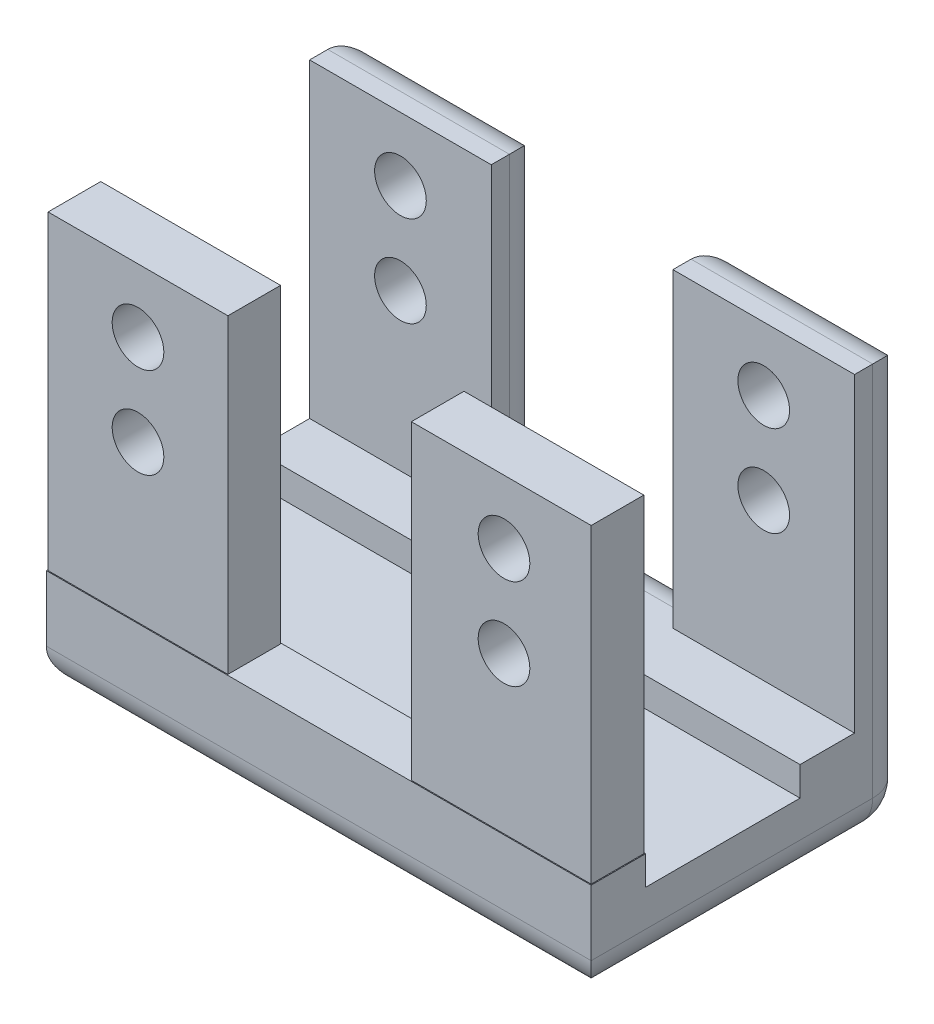
from build123d import *

# Parameters (mm, degrees)
SKETCH1_W           = 30
SKETCH1_H           = 17.5
BOSS_EXTRUDE1_DEPTH = 4
SKETCH2_W           = 30
SKETCH2_H           = 6
BOSS_EXTRUDE2_DEPTH = 1.601
SKETCH3_W           = 10
SKETCH3_H           = 3
BOSS_EXTRUDE3_DEPTH = 18.7
SKETCH4_W           = 10
SKETCH4_H           = 3
BOSS_EXTRUDE4_DEPTH = 17.099
SKETCH5_W           = 10
SKETCH5_H           = 3
BOSS_EXTRUDE5_DEPTH = 1.601
FILLET1_R           = 2
CUT_EXTRUDE1_REACH  = 42.318
SKETCH6_R           = 1.4224
CUT_EXTRUDE2_REACH  = 42.318
SKETCH7_R           = 1.4224
SKETCH9_W           = 10
SKETCH9_H           = 3
SKETCH9_W_2         = 9.9
SKETCH9_H_2         = 2.9
CUT_EXTRUDE3_DEPTH  = 17.099


with BuildPart() as part:
    # Sketch1 → Boss-Extrude1 (new body)
    with BuildSketch(Plane(origin=(0, 0, 0), x_dir=(1, 0, 0), z_dir=(0, 1, 0))):
        with Locations((15, 8.75)):
            Rectangle(SKETCH1_W, SKETCH1_H)
    extrude(amount=BOSS_EXTRUDE1_DEPTH)

    # Sketch2 → Boss-Extrude2 (add)
    with BuildSketch(Plane(origin=(0, 4, 0), x_dir=(1, 0, 0), z_dir=(0, 1, 0))):
        with Locations((15, 14.5)):
            Rectangle(SKETCH2_W, SKETCH2_H)
    extrude(amount=BOSS_EXTRUDE2_DEPTH)

    # Sketch3 → Boss-Extrude3 (add)
    with BuildSketch(Plane(origin=(0, 4, 0), x_dir=(1, 0, 0), z_dir=(0, 1, 0))):
        with Locations((5, 1.5)):
            Rectangle(SKETCH3_W, SKETCH3_H)
        with Locations((25, 1.5)):
            Rectangle(SKETCH3_W, SKETCH3_H)
    extrude(amount=BOSS_EXTRUDE3_DEPTH)

    # Sketch4 → Boss-Extrude4 (add)
    with BuildSketch(Plane(origin=(0, 5.601, 0), x_dir=(1, 0, 0), z_dir=(0, 1, 0))):
        with Locations((5, 16)):
            Rectangle(SKETCH4_W, SKETCH4_H)
        with Locations((25, 16)):
            Rectangle(SKETCH4_W, SKETCH4_H)
    extrude(amount=BOSS_EXTRUDE4_DEPTH)

    # Sketch5 → Boss-Extrude5 (add)
    with BuildSketch(Plane(origin=(0, 4, 0), x_dir=(1, 0, 0), z_dir=(0, 1, 0))):
        with Locations((15, 1.5)):
            Rectangle(SKETCH5_W, SKETCH5_H)
    extrude(amount=BOSS_EXTRUDE5_DEPTH)

    # Fillet1
    fillet1_edges = [part.edges().sort_by_distance(p)[0] for p in [
        (15, 0, -17.5),
        (30, 0, -8.75),
        (15, 0, 0),
        (10, 14.1505, -17.5),
        (5, 22.7, -17.5),
        (0, 0, -8.75),
        (15, 5.601, -17.5),
        (20, 14.1505, -17.5),
        (25, 22.7, -17.5),
        (0, 11.35, -17.5),
        (30, 11.35, -17.5),
    ]]
    fillet(fillet1_edges, radius=FILLET1_R)

    # Sketch6 → Cut-Extrude1 (cut, up to next)
    with BuildSketch(Plane.XY.offset(-14.5), mode=Mode.PRIVATE) as cut_extrude1_sk1:
        with Locations((5, 19.2)):
            Circle(SKETCH6_R)
    cut_extrude1_tool1 = extrude(cut_extrude1_sk1.sketch, amount=-CUT_EXTRUDE1_REACH, mode=Mode.PRIVATE) & part.part
    # Sketch6 → Cut-Extrude1 (cut, up to next)
    with BuildSketch(Plane.XY.offset(-14.5), mode=Mode.PRIVATE) as cut_extrude1_sk2:
        with Locations((25, 19.2)):
            Circle(SKETCH6_R)
    cut_extrude1_tool2 = extrude(cut_extrude1_sk2.sketch, amount=-CUT_EXTRUDE1_REACH, mode=Mode.PRIVATE) & part.part
    # Sketch6 → Cut-Extrude1 (cut, up to next)
    with BuildSketch(Plane.XY.offset(-14.5), mode=Mode.PRIVATE) as cut_extrude1_sk3:
        with Locations((5, 14.2)):
            Circle(SKETCH6_R)
    cut_extrude1_tool3 = extrude(cut_extrude1_sk3.sketch, amount=-CUT_EXTRUDE1_REACH, mode=Mode.PRIVATE) & part.part
    # Sketch6 → Cut-Extrude1 (cut, up to next)
    with BuildSketch(Plane.XY.offset(-14.5), mode=Mode.PRIVATE) as cut_extrude1_sk4:
        with Locations((25, 14.2)):
            Circle(SKETCH6_R)
    cut_extrude1_tool4 = extrude(cut_extrude1_sk4.sketch, amount=-CUT_EXTRUDE1_REACH, mode=Mode.PRIVATE) & part.part
    add(cut_extrude1_tool1.solids().sort_by_distance((5, 19.2, -14.5))[0], mode=Mode.SUBTRACT)
    add(cut_extrude1_tool2.solids().sort_by_distance((25, 19.2, -14.5))[0], mode=Mode.SUBTRACT)
    add(cut_extrude1_tool3.solids().sort_by_distance((5, 14.2, -14.5))[0], mode=Mode.SUBTRACT)
    add(cut_extrude1_tool4.solids().sort_by_distance((25, 14.2, -14.5))[0], mode=Mode.SUBTRACT)

    # Sketch7 → Cut-Extrude2 (cut, up to next)
    with BuildSketch(Plane(origin=(0, 0, -3), x_dir=(-1, 0, 0), z_dir=(0, 0, -1)), mode=Mode.PRIVATE) as cut_extrude2_sk1:
        with Locations(Location((-5, 19.2, 0), (0, 0, 180))):
            Circle(SKETCH7_R)
    cut_extrude2_tool1 = extrude(cut_extrude2_sk1.sketch, amount=-CUT_EXTRUDE2_REACH, mode=Mode.PRIVATE) & part.part
    # Sketch7 → Cut-Extrude2 (cut, up to next)
    with BuildSketch(Plane(origin=(0, 0, -3), x_dir=(-1, 0, 0), z_dir=(0, 0, -1)), mode=Mode.PRIVATE) as cut_extrude2_sk2:
        with Locations((-25.150725931, 19.2)):
            Circle(SKETCH7_R)
    cut_extrude2_tool2 = extrude(cut_extrude2_sk2.sketch, amount=-CUT_EXTRUDE2_REACH, mode=Mode.PRIVATE) & part.part
    # Sketch7 → Cut-Extrude2 (cut, up to next)
    with BuildSketch(Plane(origin=(0, 0, -3), x_dir=(-1, 0, 0), z_dir=(0, 0, -1)), mode=Mode.PRIVATE) as cut_extrude2_sk3:
        with Locations((-25.150725931, 14.2)):
            Circle(SKETCH7_R)
    cut_extrude2_tool3 = extrude(cut_extrude2_sk3.sketch, amount=-CUT_EXTRUDE2_REACH, mode=Mode.PRIVATE) & part.part
    # Sketch7 → Cut-Extrude2 (cut, up to next)
    with BuildSketch(Plane(origin=(0, 0, -3), x_dir=(-1, 0, 0), z_dir=(0, 0, -1)), mode=Mode.PRIVATE) as cut_extrude2_sk4:
        with Locations(Location((-5, 14.2, 0), (0, 0, 180))):
            Circle(SKETCH7_R)
    cut_extrude2_tool4 = extrude(cut_extrude2_sk4.sketch, amount=-CUT_EXTRUDE2_REACH, mode=Mode.PRIVATE) & part.part
    add(cut_extrude2_tool1.solids().sort_by_distance((5, 19.2, -3))[0], mode=Mode.SUBTRACT)
    add(cut_extrude2_tool2.solids().sort_by_distance((25.150726, 19.2, -3))[0], mode=Mode.SUBTRACT)
    add(cut_extrude2_tool3.solids().sort_by_distance((25.150726, 14.2, -3))[0], mode=Mode.SUBTRACT)
    add(cut_extrude2_tool4.solids().sort_by_distance((5, 14.2, -3))[0], mode=Mode.SUBTRACT)

    # Sketch9 → Cut-Extrude3 (cut)
    # profile 1 of 2: a face of its own
    with BuildSketch(Plane(origin=(0, 22.7, 0), x_dir=(1, 0, 0), z_dir=(0, 1, 0))):
        with Locations((25, 1.5)):
            Rectangle(SKETCH9_W, SKETCH9_H)
        with Locations((25, 1.5)):
            Rectangle(SKETCH9_W_2, SKETCH9_H_2, mode=Mode.SUBTRACT)
    # profile 2 of 2: a face of its own
    with BuildSketch(Plane(origin=(0, 22.7, 0), x_dir=(1, 0, 0), z_dir=(0, 1, 0))):
        with Locations((5, 1.5)):
            Rectangle(SKETCH9_W, SKETCH9_H)
        with Locations((5, 1.5)):
            Rectangle(SKETCH9_W_2, SKETCH9_H_2, mode=Mode.SUBTRACT)
    extrude(amount=-CUT_EXTRUDE3_DEPTH, mode=Mode.SUBTRACT)


solid = part.part
